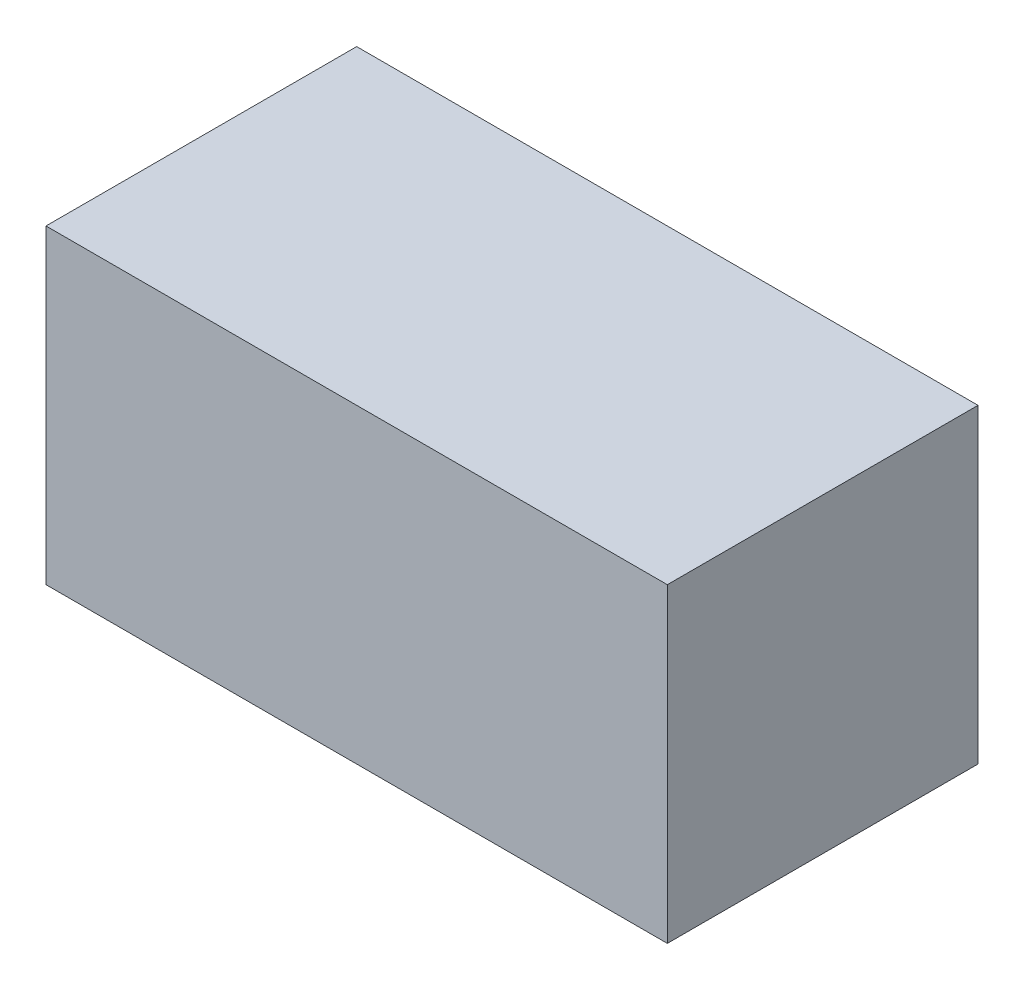
from build123d import *

# Parameters (mm, degrees)
SKETCH1_W           = 9.5
SKETCH1_H           = 4.75
BOSS_EXTRUDE1_DEPTH = 4.75


with BuildPart() as part:
    # Sketch1 → Boss-Extrude1 (new body)
    with BuildSketch(Plane.XY):
        with Locations((4.75, 2.375)):
            Rectangle(SKETCH1_W, SKETCH1_H)
    extrude(amount=BOSS_EXTRUDE1_DEPTH)


solid = part.part
